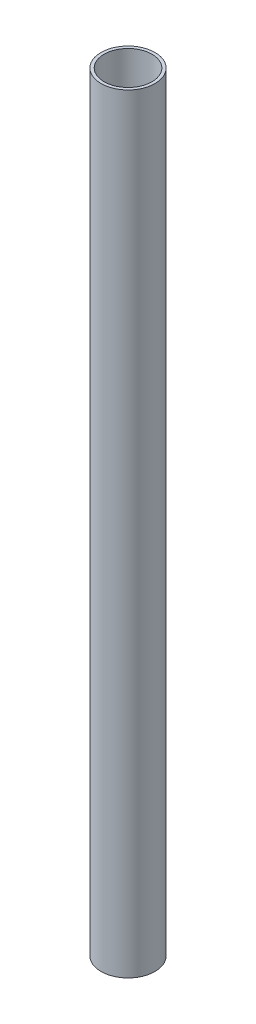
from build123d import *

# Parameters (mm, degrees)
SKETCH1_R           = 7.9375
SKETCH1_R_2         = 7.0485
BOSS_EXTRUDE1_DEPTH = 226.52


with BuildPart() as part:
    # Sketch1 → Boss-Extrude1 (new body)
    with BuildSketch(Plane(origin=(0, 0, 0), x_dir=(1, 0, 0), z_dir=(0, 1, 0))):
        with Locations(Location((13.632659162, 6.079429086, 0), (0, 0, 90))):
            Circle(SKETCH1_R)
        with Locations(Location((13.632659162, 6.079429086, 0), (0, 0, 90))):
            Circle(SKETCH1_R_2, mode=Mode.SUBTRACT)
    extrude(amount=BOSS_EXTRUDE1_DEPTH)


solid = part.part
